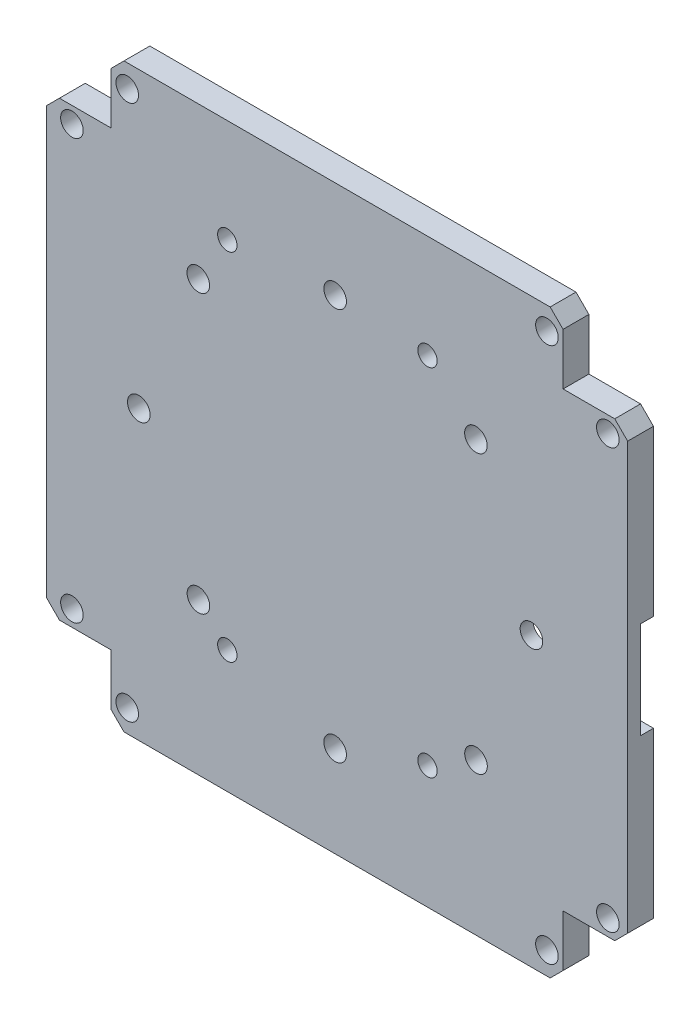
from build123d import *

# Parameters (mm, degrees)
SKETCH1_W           = 90
SKETCH1_H           = 70
BOSS_EXTRUDE1_DEPTH = 4
SKETCH2_R           = 1.75
CUT_EXTRUDE1_DEPTH  = 5
CHAMFER1_SIZE       = 2
CHAMFER2_SIZE       = 2
CHAMFER3_SIZE       = 2
CHAMFER4_SIZE       = 2
SKETCH5_W           = 70
SKETCH5_H           = 4
BOSS_EXTRUDE3_DEPTH = 10
SKETCH4_W           = 70
SKETCH4_H           = 4
BOSS_EXTRUDE4_DEPTH = 10
SKETCH6_R           = 1.75
CUT_EXTRUDE2_DEPTH  = 10
CHAMFER5_SIZE       = 2
SKETCH7_W           = 40
SKETCH7_H           = 40
CUT_EXTRUDE3_DEPTH  = 2
SKETCH8_W           = 25
SKETCH8_H           = 15
CUT_EXTRUDE4_DEPTH  = 2
SKETCH9_R           = 1.5
CUT_EXTRUDE5_DEPTH  = 4
SKETCH10_R          = 1.75
CUT_EXTRUDE6_DEPTH  = 10


with BuildPart() as part:
    # Sketch1 → Boss-Extrude1 (new body)
    with BuildSketch(Plane.XY):
        with Locations((44.768273235, 35.193370166)):
            Rectangle(SKETCH1_W, SKETCH1_H)
    extrude(amount=BOSS_EXTRUDE1_DEPTH)

    # Sketch2 → Cut-Extrude1 (cut)
    with BuildSketch(Plane.XY.offset(4)):
        with Locations((3.703568783, 2.693370166)):
            Circle(SKETCH2_R)
        with Locations((86.703568783, 2.694436567)):
            Circle(SKETCH2_R)
        with Locations((86.703273235, 67.693370166)):
            Circle(SKETCH2_R)
        with Locations((3.703273235, 67.693370166)):
            Circle(SKETCH2_R)
        with Locations((23.297725672, 13.693370166)):
            Circle(SKETCH2_R)
        with Locations((66.284051901, 13.693370166)):
            Circle(SKETCH2_R)
        with Locations((66.268273235, 56.693370166)):
            Circle(SKETCH2_R)
        with Locations((23.268273235, 56.693370166)):
            Circle(SKETCH2_R)
    extrude(amount=-CUT_EXTRUDE1_DEPTH, mode=Mode.SUBTRACT)

    # Chamfer1
    chamfer1_edges = [part.edges().sort_by_distance(p)[0] for p in [
        (89.768273235, 0.193370166, 2),
    ]]
    chamfer(chamfer1_edges, length=CHAMFER1_SIZE)

    # Chamfer2
    chamfer2_edges = [part.edges().sort_by_distance(p)[0] for p in [
        (-0.231726765, 0.193370166, 2),
    ]]
    chamfer(chamfer2_edges, length=CHAMFER2_SIZE)

    # Chamfer3
    chamfer3_edges = [part.edges().sort_by_distance(p)[0] for p in [
        (-0.231726765, 70.193370166, 2),
    ]]
    chamfer(chamfer3_edges, length=CHAMFER3_SIZE)

    # Chamfer4
    chamfer4_edges = [part.edges().sort_by_distance(p)[0] for p in [
        (89.768273235, 70.193370166, 2),
    ]]
    chamfer(chamfer4_edges, length=CHAMFER4_SIZE)

    # Sketch5 → Boss-Extrude3 (add)
    with BuildSketch(Plane(origin=(0, 70.193370166, 0), x_dir=(1, 0, 0), z_dir=(0, 1, 0))):
        with Locations((44.768273235, -2)):
            Rectangle(SKETCH5_W, SKETCH5_H)
    extrude(amount=BOSS_EXTRUDE3_DEPTH)

    # Sketch4 → Boss-Extrude4 (add)
    with BuildSketch(Plane(origin=(0, 0.193370166, 0), x_dir=(-1, 0, 0), z_dir=(0, -1, 0))):
        with Locations((-44.768273235, -2)):
            Rectangle(SKETCH4_W, SKETCH4_H)
    extrude(amount=BOSS_EXTRUDE4_DEPTH)

    # Sketch6 → Cut-Extrude2 (cut)
    with BuildSketch(Plane(origin=(0, 0, 0), x_dir=(-1, 0, 0), z_dir=(0, 0, -1))):
        with Locations((-12.268273235, 76.693370166)):
            Circle(SKETCH6_R)
        with Locations((-77.268273235, 76.693370166)):
            Circle(SKETCH6_R)
        with Locations((-77.268273235, -6.306629834)):
            Circle(SKETCH6_R)
        with Locations((-12.268273235, -6.306629834)):
            Circle(SKETCH6_R)
    extrude(amount=-CUT_EXTRUDE2_DEPTH, mode=Mode.SUBTRACT)

    # Chamfer5
    chamfer5_edges = [part.edges().sort_by_distance(p)[0] for p in [
        (9.768273235, 80.193370166, 2),
        (79.768273235, 80.193370166, 2),
        (9.768273235, -9.806629834, 2),
        (79.768273235, -9.806629834, 2),
    ]]
    chamfer(chamfer5_edges, length=CHAMFER5_SIZE)

    # Sketch7 → Cut-Extrude3 (cut)
    with BuildSketch(Plane(origin=(0, 0, 0), x_dir=(-1, 0, 0), z_dir=(0, 0, -1))):
        with Locations((-44.768273235, 35.193370166)):
            Rectangle(SKETCH7_W, SKETCH7_H)
    extrude(amount=-CUT_EXTRUDE3_DEPTH, mode=Mode.SUBTRACT)

    # Sketch8 → Cut-Extrude4 (cut)
    with BuildSketch(Plane(origin=(0, 0, 0), x_dir=(-1, 0, 0), z_dir=(0, 0, -1))):
        with Locations((-77.268273235, 35.193370166)):
            Rectangle(SKETCH8_W, SKETCH8_H)
    extrude(amount=-CUT_EXTRUDE4_DEPTH, mode=Mode.SUBTRACT)

    # Sketch9 → Cut-Extrude5 (cut)
    with BuildSketch(Plane(origin=(0, 0, 0), x_dir=(-1, 0, 0), z_dir=(0, 0, -1))):
        with Locations((-27.768273235, 9.193370166)):
            Circle(SKETCH9_R)
        with Locations((-58.768273235, 9.193370166)):
            Circle(SKETCH9_R)
        with Locations((-27.768273235, 64.193370166)):
            Circle(SKETCH9_R)
        with Locations((-58.768273235, 64.193370166)):
            Circle(SKETCH9_R)
    extrude(amount=-CUT_EXTRUDE5_DEPTH, mode=Mode.SUBTRACT)

    # Sketch10 → Cut-Extrude6 (cut)
    with BuildSketch(Plane(origin=(0, 0, 0), x_dir=(-1, 0, 0), z_dir=(0, 0, -1))):
        with Locations((-74.871589862, 34.731015085)):
            Circle(SKETCH10_R)
        with Locations((-44.465998271, 4.325423494)):
            Circle(SKETCH10_R)
        with Locations((-14.06040668, 34.731015085)):
            Circle(SKETCH10_R)
        with Locations((-44.465998271, 65.136606676)):
            Circle(SKETCH10_R)
    extrude(amount=-CUT_EXTRUDE6_DEPTH, mode=Mode.SUBTRACT)


solid = part.part
